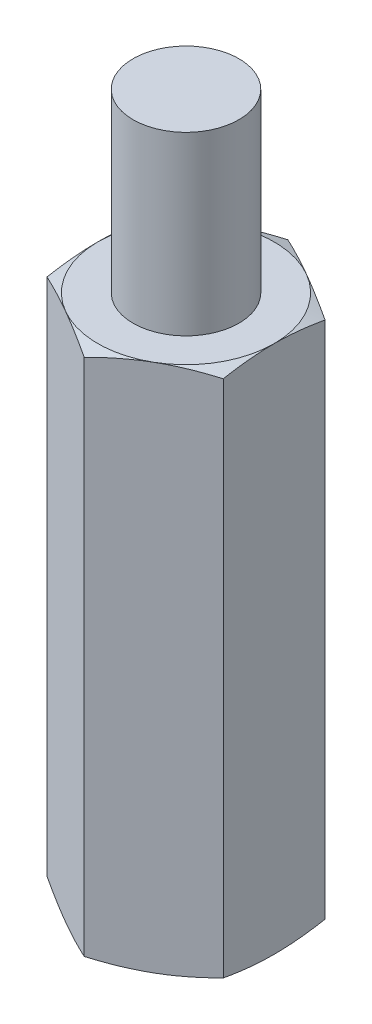
from build123d import *

# Parameters (mm, degrees)
SKETCH1_R           = 1.5
BOSS_EXTRUDE1_DEPTH = 15
SKETCH7_R           = 1.5
BOSS_EXTRUDE2_DEPTH = 5


with BuildPart() as part:
    # Sketch1 → Boss-Extrude1 (new body)
    with BuildSketch(Plane(origin=(0, 0, 0), x_dir=(1, 0, 0), z_dir=(0, 1, 0))):
        Polygon((0, 2.886751346), (-2.5, 1.443375673), (-2.5, -1.443375673), (0, -2.886751346), (2.5, -1.443375673), (2.5, 1.443375673), align=None)
        with Locations(Location((0, 0, 0), (0, 0, 270))):
            Circle(SKETCH1_R, mode=Mode.SUBTRACT)
    extrude(amount=BOSS_EXTRUDE1_DEPTH)

    # Sketch6 → Cut-Revolve1 (revolve, cut)
    with BuildSketch(Plane.ZY):
        Polygon((2.5, 15), (2.886751346, 15), (2.886751346, 14.859234022), align=None)
    cut_revolve1 = revolve(axis=Axis((0, 15, 0), (0, 1, 0)), mode=Mode.SUBTRACT)

    # Mirror1: Cut-Revolve1 across plane
    add(cut_revolve1.mirror(Plane.ZX.offset(7.5)), mode=Mode.SUBTRACT)


with BuildPart() as body_2:
    # Sketch7 → Boss-Extrude2 (new body)
    with BuildSketch(Plane(origin=(0, 15, 0), x_dir=(1, 0, 0), z_dir=(0, 1, 0))):
        with Locations(Location((0, 0, 0), (0, 0, 270))):
            Circle(SKETCH7_R)
    extrude(amount=BOSS_EXTRUDE2_DEPTH)


solid = Compound([part.part, body_2.part])
